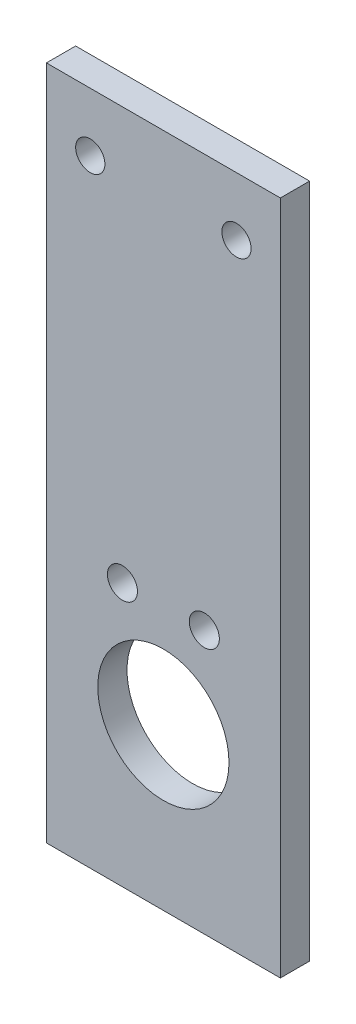
from build123d import *

# Parameters (mm, degrees)
SKETCH1_W           = 50.8
SKETCH1_H           = 146.685
SKETCH1_R           = 14.2494
SKETCH1_R_2         = 3.175
BOSS_EXTRUDE3_DEPTH = 6.35
SKETCH2_R           = 3.2639
CUT_EXTRUDE1_DEPTH  = 150.003260786


with BuildPart() as part:
    # Sketch1 → Boss-Extrude3 (new body)
    with BuildSketch(Plane.XY):
        with Locations((0, -73.3425)):
            Rectangle(SKETCH1_W, SKETCH1_H)
        with Locations((0, -111.76)):
            Circle(SKETCH1_R, mode=Mode.SUBTRACT)
        with Locations((-15.875, -12.7)):
            Circle(SKETCH1_R_2, mode=Mode.SUBTRACT)
        with Locations((15.875, -12.7)):
            Circle(SKETCH1_R_2, mode=Mode.SUBTRACT)
    extrude(amount=BOSS_EXTRUDE3_DEPTH)

    # Sketch2 → Cut-Extrude1 (cut, through all)
    with BuildSketch(Plane.XY.offset(6.35)):
        with Locations((8.89, -89.535)):
            Circle(SKETCH2_R)
        with Locations((-8.89, -89.535)):
            Circle(SKETCH2_R)
    extrude(amount=-CUT_EXTRUDE1_DEPTH, mode=Mode.SUBTRACT)


solid = part.part
